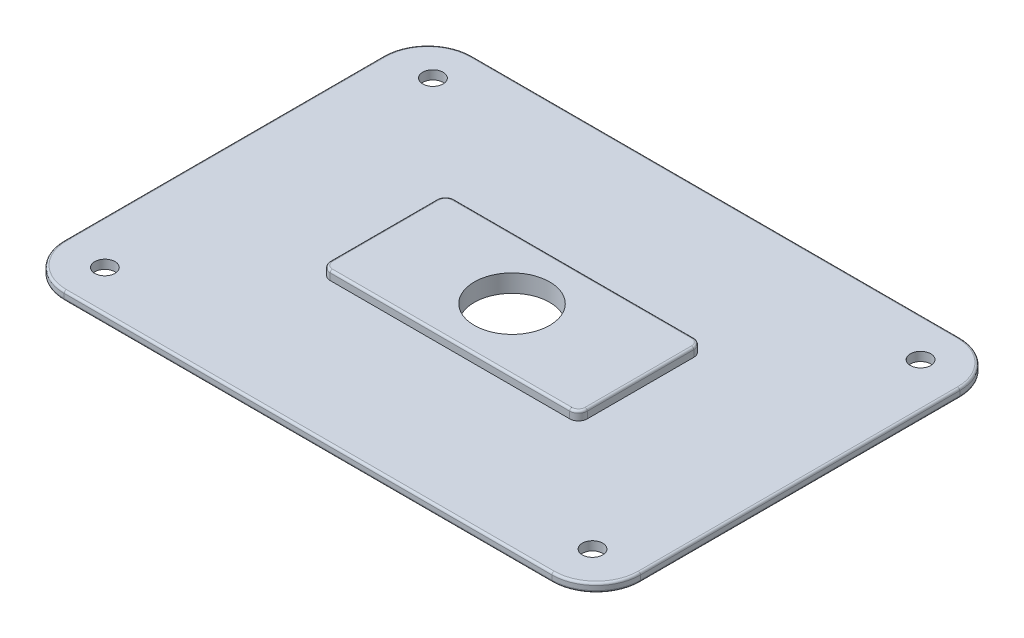
from build123d import *

# Parameters (mm, degrees)
SKETCH1_W           = 130
SKETCH1_H           = 92
SKETCH1_R           = 2.3
BOSS_EXTRUDE1_DEPTH = 2
SKETCH2_W           = 58
SKETCH2_H           = 28
BOSS_EXTRUDE2_DEPTH = 4
FILLET1_R           = 10
FILLET2_R           = 2
FILLET3_R           = 0.5
SKETCH3_R           = 8.5
CUT_EXTRUDE1_DEPTH  = 146.86690412


with BuildPart() as part:
    # Sketch1 → Boss-Extrude1 (new body)
    with BuildSketch(Plane(origin=(0, 0, 0), x_dir=(1, 0, 0), z_dir=(0, 1, 0))):
        with Locations((54.9842552, 36.854886379)):
            Rectangle(SKETCH1_W, SKETCH1_H)
        with Locations(Location((0, 74, 0), (0, 0, 270))):
            Circle(SKETCH1_R, mode=Mode.SUBTRACT)
        with Locations(Location((110, 74, 0), (0, 0, 90))):
            Circle(SKETCH1_R, mode=Mode.SUBTRACT)
        with Locations(Location((110, 0, 0), (0, 0, 270))):
            Circle(SKETCH1_R, mode=Mode.SUBTRACT)
        with Locations(Location((0, 0, 0), (0, 0, 90))):
            Circle(SKETCH1_R, mode=Mode.SUBTRACT)
    extrude(amount=BOSS_EXTRUDE1_DEPTH)

    # Sketch2 → Boss-Extrude2 (add)
    with BuildSketch(Plane(origin=(0, 0, 0), x_dir=(1, 0, 0), z_dir=(0, 1, 0))):
        with Locations((54.9842552, 36.854886379)):
            Rectangle(SKETCH2_W, SKETCH2_H)
    extrude(amount=BOSS_EXTRUDE2_DEPTH)

    # Fillet1
    fillet1_edges = [part.edges().sort_by_distance(p)[0] for p in [
        (-10.0157448, 1, -82.854886379),
        (119.9842552, 1, -82.854886379),
        (119.9842552, 1, 9.145113621),
        (-10.0157448, 1, 9.145113621),
    ]]
    fillet(fillet1_edges, radius=FILLET1_R)

    # Fillet2
    fillet2_edges = [part.edges().sort_by_distance(p)[0] for p in [
        (25.9842552, 3, -50.854886379),
        (25.9842552, 3, -22.854886379),
        (83.9842552, 3, -22.854886379),
        (83.9842552, 3, -50.854886379),
    ]]
    fillet(fillet2_edges, radius=FILLET2_R)

    # Fillet3
    fillet3_edges = [part.edges().sort_by_distance(p)[0] for p in [
        (54.9842552, 0, -82.854886379),
        (54.9842552, 2, -82.854886379),
        (-10.0157448, 0, -36.854886379),
        (119.9842552, 0, -36.854886379),
        (54.9842552, 0, 9.145113621),
        (-7.086812612, 0, -79.925954191),
        (-7.086812612, 0, 6.216181433),
        (117.055323011, 0, 6.216181433),
        (117.055323011, 0, -79.925954191),
        (119.9842552, 2, -36.854886379),
        (-10.0157448, 2, -36.854886379),
        (54.9842552, 2, 9.145113621),
        (-7.086812612, 2, -79.925954191),
        (-7.086812612, 2, 6.216181433),
        (117.055323011, 2, 6.216181433),
        (117.055323011, 2, -79.925954191),
        (25.9842552, 4, -36.854886379),
        (54.9842552, 4, -50.854886379),
        (54.9842552, 4, -22.854886379),
        (83.9842552, 4, -36.854886379),
        (26.570041637, 4, -23.440672817),
        (83.398468762, 4, -23.440672817),
        (83.398468762, 4, -50.269099942),
        (26.570041637, 4, -50.269099942),
    ]]
    fillet(fillet3_edges, radius=FILLET3_R)

    # Sketch3 → Cut-Extrude1 (cut, through all)
    with BuildSketch(Plane(origin=(0, 0, 0), x_dir=(1, 0, 0), z_dir=(0, 1, 0))):
        with Locations(Location((54.9842552, 36.854886379, 0), (0, 0, 270))):
            Circle(SKETCH3_R)
    extrude(amount=CUT_EXTRUDE1_DEPTH, mode=Mode.SUBTRACT)


solid = part.part
